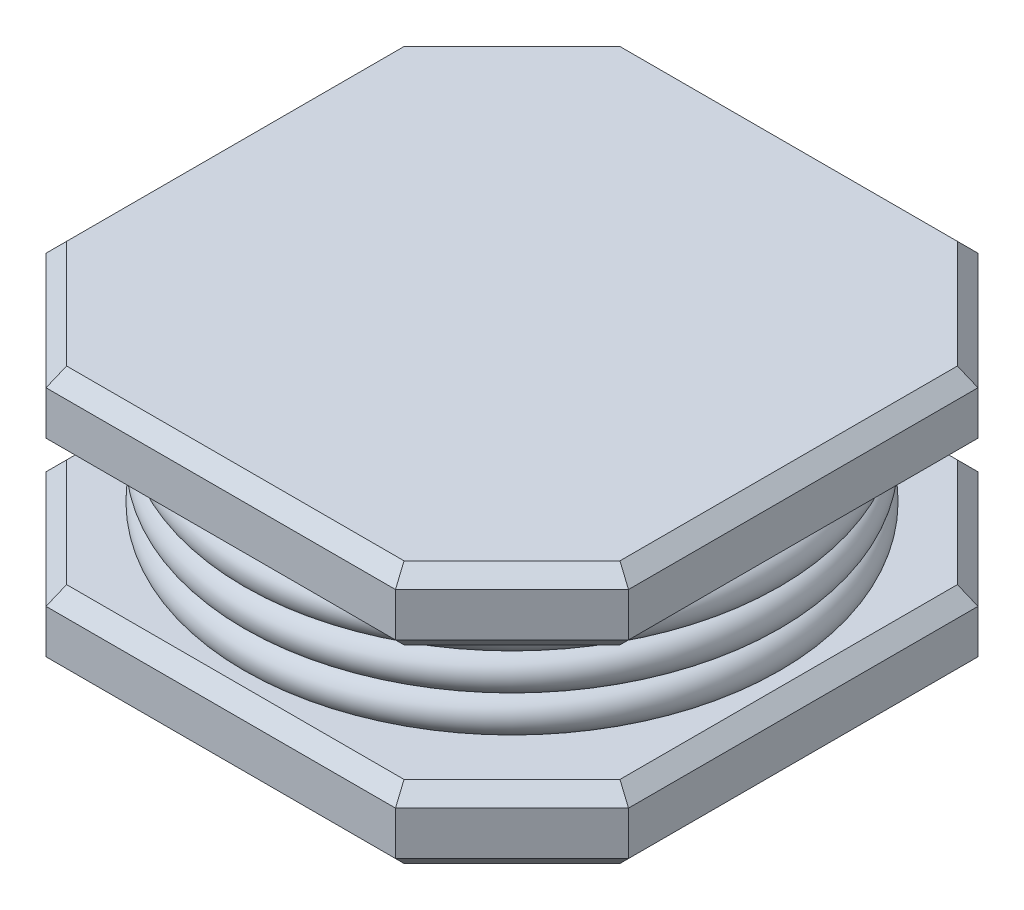
from build123d import *

# Parameters (mm, degrees)
BASES_W              = 4
BASES_H              = 4
BASE_DEPTH           = 0.5
COILENCASEMENTS_R    = 1.5
COILENCASEMENT_DEPTH = 0.8
TOPBASES_W           = 4
TOPBASES_H           = 4
TOPBASE_DEPTH        = 0.5
COIL_PROFILE_R       = 0.125
COIL_P_COUNT         = 3
COIL_P_PITCH         = 0.25
CHAMFER1_SIZE        = 0.8
BASES_C_SIZE         = 0.1


with BuildPart() as part:
    # BaseS → Base (new body)
    with BuildSketch(Plane(origin=(0, 0, 0), x_dir=(1, 0, 0), z_dir=(0, 1, 0))):
        Rectangle(BASES_W, BASES_H)
    extrude(amount=BASE_DEPTH)

    # CoilEncasementS → CoilEncasement (add)
    with BuildSketch(Plane(origin=(0, 0.5, 0), x_dir=(1, 0, 0), z_dir=(0, 1, 0))):
        with Locations(Location((0, 0, 0), (0, 0, 90))):
            Circle(COILENCASEMENTS_R)
    extrude(amount=COILENCASEMENT_DEPTH)

    # TopBaseS → TopBase (add)
    with BuildSketch(Plane(origin=(0, 1.3, 0), x_dir=(1, 0, 0), z_dir=(0, 1, 0))):
        Rectangle(TOPBASES_W, TOPBASES_H)
    extrude(amount=TOPBASE_DEPTH)

    # Chamfer1
    chamfer1_edges = [part.edges().sort_by_distance(p)[0] for p in [
        (2, 1.55, 2),
        (2, 1.55, -2),
        (-2, 1.55, -2),
        (-2, 1.55, 2),
        (2, 0.25, 2),
        (-2, 0.25, 2),
        (-2, 0.25, -2),
        (2, 0.25, -2),
    ]]
    chamfer(chamfer1_edges, length=CHAMFER1_SIZE)

    # BASES C
    bases_c_edges = [part.edges().sort_by_distance(p)[0] for p in [
        (0, 0.5, 1.5),
        (0, 1.3, 1.5),
        (0, 0, -2),
        (0, 0.5, -2),
        (2, 0, 0),
        (0, 0, 2),
        (-2, 0, 0),
        (1.6, 0, 1.6),
        (-1.6, 0, 1.6),
        (-1.6, 0, -1.6),
        (1.6, 0, -1.6),
        (2, 0.5, 0),
        (-2, 0.5, 0),
        (0, 0.5, 2),
        (1.6, 0.5, 1.6),
        (-1.6, 0.5, 1.6),
        (-1.6, 0.5, -1.6),
        (1.6, 0.5, -1.6),
        (0, 1.3, -2),
        (0, 1.8, -2),
        (2, 1.3, 0),
        (0, 1.3, 2),
        (-2, 1.3, 0),
        (1.6, 1.3, 1.6),
        (-1.6, 1.3, 1.6),
        (-1.6, 1.3, -1.6),
        (1.6, 1.3, -1.6),
        (2, 1.8, 0),
        (-2, 1.8, 0),
        (0, 1.8, 2),
        (1.6, 1.8, 1.6),
        (-1.6, 1.8, 1.6),
        (-1.6, 1.8, -1.6),
        (1.6, 1.8, -1.6),
    ]]
    chamfer(bases_c_edges, length=BASES_C_SIZE)


with BuildPart() as body_2:
    # Coil: sweep along a path in CoilS
    with BuildLine(Plane(origin=(0, 0.625, 0), x_dir=(1, 0, 0), z_dir=(0, 1, 0))) as coil_path:
        CenterArc((0, 0), 1.75, 0, 360)
    # Coil profile (on start of the path) → Coil (sweep)
    with BuildSketch(Plane(origin=(1.75, 0.625, 0), x_dir=(-1, 0, 0), z_dir=(0, 0, -1))):
        Circle(COIL_PROFILE_R)
    sweep(path=coil_path.line)


with BuildPart() as coil_p_1:
    # COIL P: pattern copy
    add(body_2.part.moved(Location(Vector(0, 1, 0) * (1 * COIL_P_PITCH))))


with BuildPart() as coil_p_2:
    # COIL P: pattern copy
    add(body_2.part.moved(Location(Vector(0, 1, 0) * (2 * COIL_P_PITCH))))


solid = Compound([part.part, body_2.part, coil_p_1.part, coil_p_2.part])
